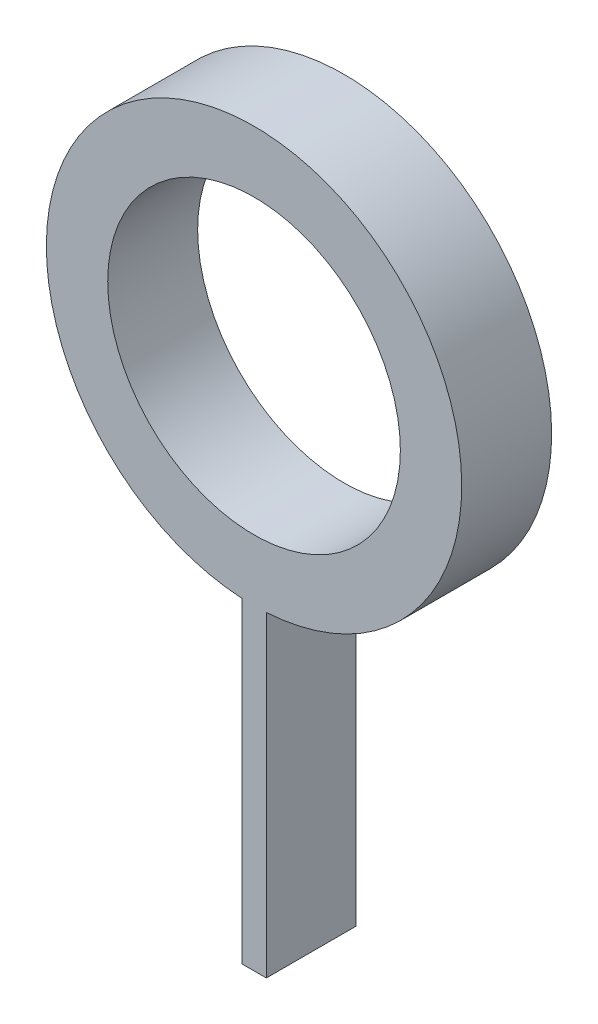
from build123d import *

# Parameters (mm, degrees)
BOSS_EXTRUDE1_DEPTH = 4.7625


with BuildPart() as part:
    # Sketch1 → Boss-Extrude1 (new body)
    # profile 1 of 5: a face of its own
    with BuildSketch(Plane.XY):
        with BuildLine():
            Line((-0.65, -7.75), (0, -7.75))
            Line((0, -7.75), (0.65, -7.75))
            Line((0.65, -7.75), (0.65, -10.980778661))
            ThreePointArc((0.65, -10.980778661), (8.004686128, -7.544865804), (11, 0))
            ThreePointArc((11, 0), (-7.544865804, 8.004686128), (-0.65, -10.980778661))
            Line((-0.65, -10.980778661), (-0.65, -7.75))
        make_face()
        with BuildLine():
            ThreePointArc((7.75, 0), (5.480077554, -5.480077554), (0, -7.75))
            ThreePointArc((0, -7.75), (-5.480077554, 5.480077554), (7.75, 0))
        make_face(mode=Mode.SUBTRACT)
    # profile 2 of 5: a face of its own
    with BuildSketch(Plane.XY):
        with BuildLine():
            Line((0.65, -7.75), (0, -7.75))
            Line((0, -7.75), (0, -11))
            ThreePointArc((0, -11), (0.325142069, -10.995193615), (0.65, -10.980778661))
            Line((0.65, -10.980778661), (0.65, -7.75))
        make_face()
    # profile 3 of 5: a face of its own
    with BuildSketch(Plane.XY):
        with BuildLine():
            Line((0, -11), (0, -7.75))
            Line((0, -7.75), (-0.65, -7.75))
            Line((-0.65, -7.75), (-0.65, -10.980778661))
            ThreePointArc((-0.65, -10.980778661), (-0.325142069, -10.995193615), (0, -11))
        make_face()
    # profile 4 of 5: a face of its own
    with BuildSketch(Plane.XY):
        with BuildLine():
            Line((0, -27.75), (0, -11))
            ThreePointArc((0, -11), (-0.325142069, -10.995193615), (-0.65, -10.980778661))
            Line((-0.65, -10.980778661), (-0.65, -27.75))
            Line((-0.65, -27.75), (0, -27.75))
        make_face()
    # profile 5 of 5: a face of its own
    with BuildSketch(Plane.XY):
        with BuildLine():
            ThreePointArc((0.65, -10.980778661), (0.325142069, -10.995193615), (0, -11))
            Line((0, -11), (0, -27.75))
            Line((0, -27.75), (0.65, -27.75))
            Line((0.65, -27.75), (0.65, -10.980778661))
        make_face()
    extrude(amount=BOSS_EXTRUDE1_DEPTH)


solid = part.part
